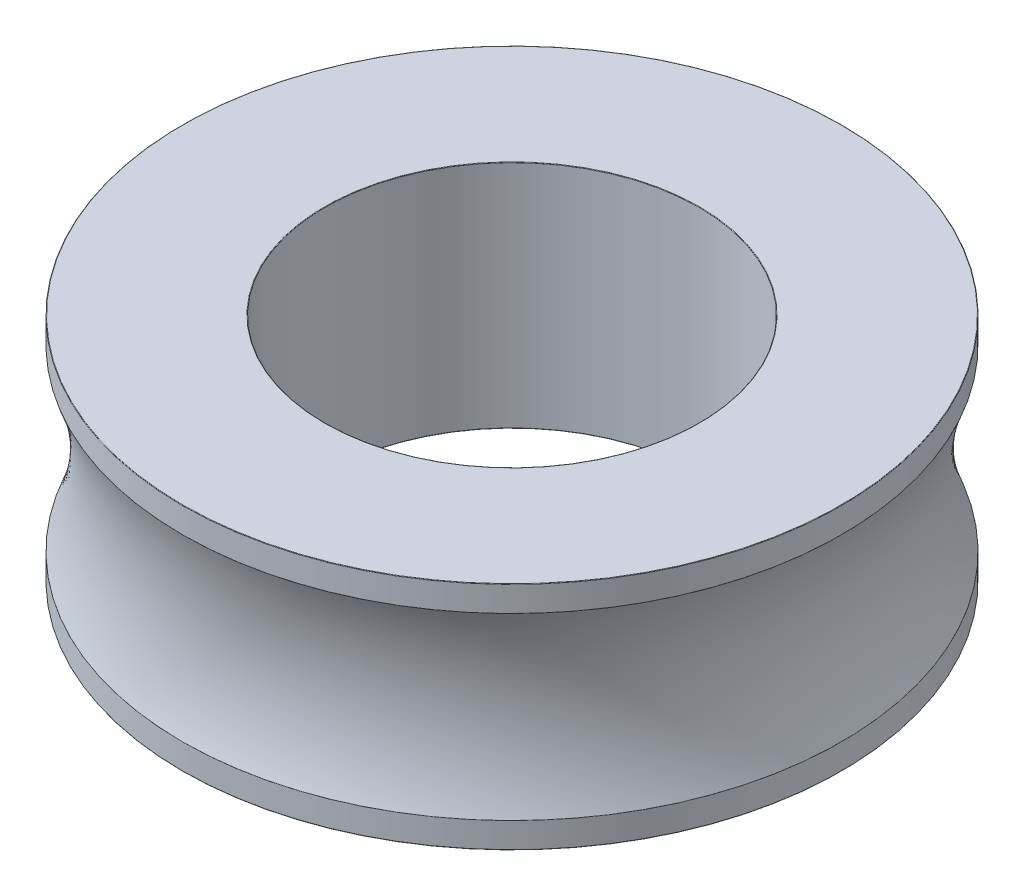
from build123d import *

# Parameters (mm, degrees)
FILLET1_R = 0.071587302


with BuildPart() as part:
    # Sketch1 → Revolve1 (revolve)
    with BuildSketch(Plane.XY, mode=Mode.PRIVATE) as revolve1_sk:
        with BuildLine():
            Line((49.663690476, 34.738392842), (28.1875, 34.738392842))
            Line((28.1875, 34.738392842), (28.1875, 0))
            Line((28.1875, 0), (49.663690476, 0))
            Line((49.663690476, 0), (49.663690476, 3.859821429))
            ThreePointArc((49.663690476, 3.859821429), (47.016415419, 17.369196421), (49.663690476, 30.878571413))
            Line((49.663690476, 30.878571413), (49.663690476, 34.738392842))
        make_face()
    revolve(revolve1_sk.sketch.rotate(Axis((0, 0, 0), (0, 1, 0)), 90), axis=Axis((0, 0, 0), (0, 1, 0)))

    # Fillet1
    fillet1_edges = [part.edges().sort_by_distance(p)[0] for p in [
        (0, 34.738392842, 28.1875),
        (0, 34.738392842, 49.663690476),
        (0, 30.878571413, 49.663690476),
        (0, 3.859821429, 49.663690476),
        (0, 0, 49.663690476),
        (0, 0, 28.1875),
    ]]
    fillet(fillet1_edges, radius=FILLET1_R)


solid = part.part
